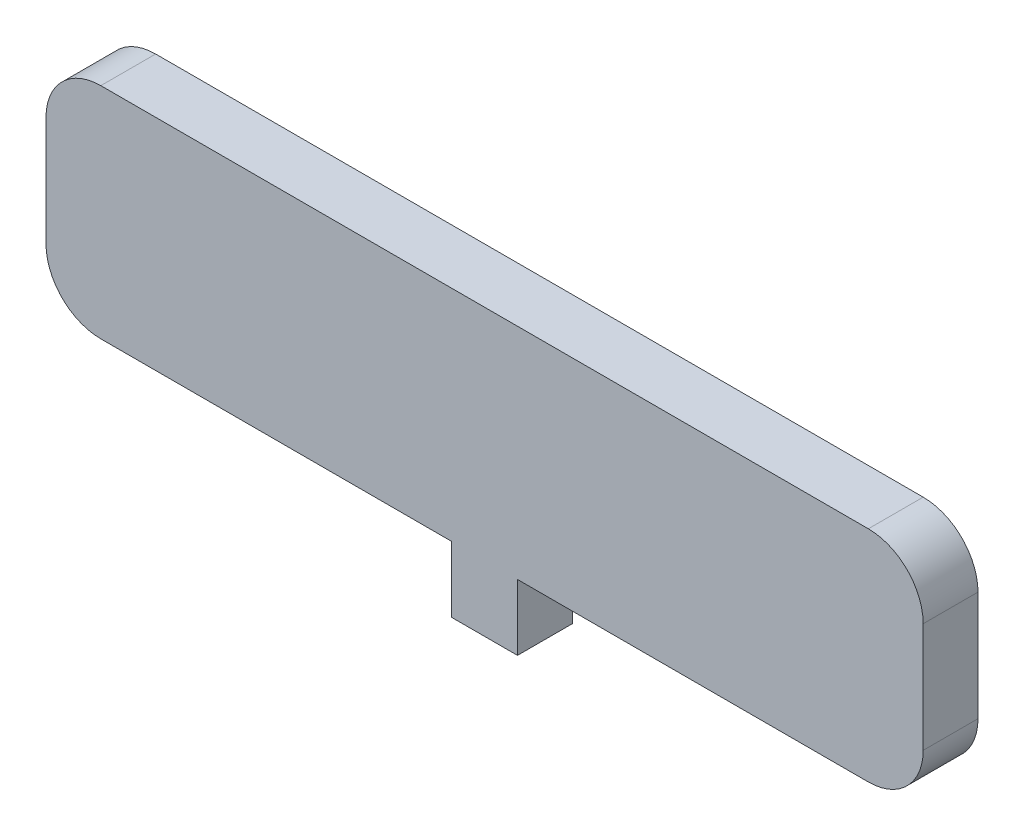
from build123d import *

# Parameters (mm, degrees)
SKETCH1_W           = 80
SKETCH1_H           = 20
BOSS_EXTRUDE1_DEPTH = 5
FILLET1_R           = 5
SHELL1_T            = -2
SKETCH2_W           = 6
SKETCH2_H           = 5
BOSS_EXTRUDE2_DEPTH = 6
SKETCH3_R           = 1.425
CUT_EXTRUDE1_DEPTH  = 4


with BuildPart() as part:
    # Sketch1 → Boss-Extrude1 (new body)
    with BuildSketch(Plane.XY):
        Rectangle(SKETCH1_W, SKETCH1_H)
    extrude(amount=BOSS_EXTRUDE1_DEPTH)

    # Fillet1
    fillet1_edges = [part.edges().sort_by_distance(p)[0] for p in [
        (40, -10, 2.5),
        (-40, -10, 2.5),
        (-40, 10, 2.5),
        (40, 10, 2.5),
    ]]
    fillet(fillet1_edges, radius=FILLET1_R)

    # Shell1
    shell1_openings = [part.faces().sort_by_distance(p)[0] for p in [
        (0, 0, 0),
    ]]
    offset(amount=SHELL1_T, openings=shell1_openings, kind=Kind.INTERSECTION)

    # Sketch2 → Boss-Extrude2 (add)
    with BuildSketch(Plane.XZ.offset(10)):
        with Locations((0, 2.5)):
            Rectangle(SKETCH2_W, SKETCH2_H)
    extrude(amount=BOSS_EXTRUDE2_DEPTH)

    # Sketch3 → Cut-Extrude1 (cut)
    with BuildSketch(Plane.XZ.offset(16)):
        with Locations(Location((0, 2.5, 0), (0, 0, 270))):
            Circle(SKETCH3_R)
    extrude(amount=-CUT_EXTRUDE1_DEPTH, mode=Mode.SUBTRACT)


solid = part.part
